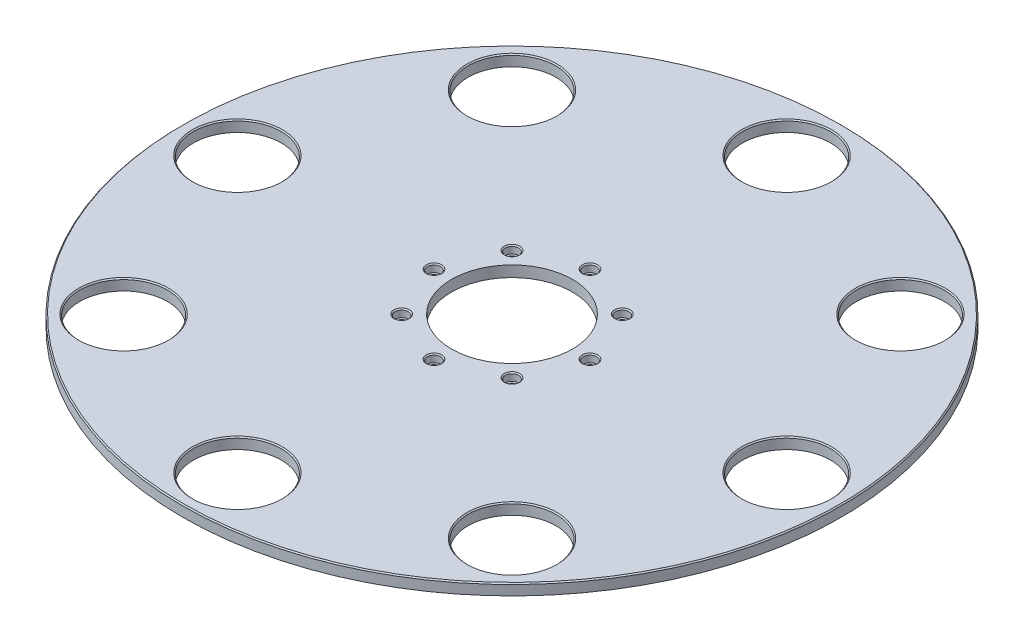
from build123d import *

# Parameters (mm, degrees)
SKETCH2_R            = 300
SKETCH2_R_2          = 55
SKETCH2_R_3          = 40
BOSS_EXTRUDE10_DEPTH = 10
CHAMFER1_SIZE        = 1
SKETCH13_R           = 6
CUT_EXTRUDE1_DEPTH   = 7
SKETCH14_R           = 4
CUT_EXTRUDE2_DEPTH   = 3
CHAMFER2_SIZE        = 1


with BuildPart() as part:
    # Sketch2 → Boss-Extrude10 (new body)
    with BuildSketch(Plane(origin=(0, 0, 0), x_dir=(1, 0, 0), z_dir=(0, 1, 0))):
        with Locations(Location((0, 0, 0), (0, 0, 270))):
            Circle(SKETCH2_R)
        with Locations(Location((0, 0, 0), (0, 0, 270))):
            Circle(SKETCH2_R_2, mode=Mode.SUBTRACT)
        with Locations(Location((0, 250, 0), (0, 0, 270))):
            Circle(SKETCH2_R_3, mode=Mode.SUBTRACT)
        with Locations(Location((176.776695297, 176.776695297, 0), (0, 0, 270))):
            Circle(SKETCH2_R_3, mode=Mode.SUBTRACT)
        with Locations(Location((250, 0, 0), (0, 0, 270))):
            Circle(SKETCH2_R_3, mode=Mode.SUBTRACT)
        with Locations(Location((176.776695297, -176.776695297, 0), (0, 0, 270))):
            Circle(SKETCH2_R_3, mode=Mode.SUBTRACT)
        with Locations(Location((0, -250, 0), (0, 0, 270))):
            Circle(SKETCH2_R_3, mode=Mode.SUBTRACT)
        with Locations(Location((-176.776695297, -176.776695297, 0), (0, 0, 270))):
            Circle(SKETCH2_R_3, mode=Mode.SUBTRACT)
        with Locations(Location((-250, 0, 0), (0, 0, 270))):
            Circle(SKETCH2_R_3, mode=Mode.SUBTRACT)
        with Locations(Location((-176.776695297, 176.776695297, 0), (0, 0, 270))):
            Circle(SKETCH2_R_3, mode=Mode.SUBTRACT)
    extrude(amount=BOSS_EXTRUDE10_DEPTH)

    # Chamfer1
    chamfer1_edges = [part.edges().sort_by_distance(p)[0] for p in [
        (176.776695297, 10, -216.776695297),
        (250, 10, -40),
        (176.776695297, 10, 136.776695297),
        (0, 10, 210),
        (-176.776695297, 10, 136.776695297),
        (-250, 10, -40),
        (-176.776695297, 10, -216.776695297),
        (0, 10, -300),
        (0, 10, -290),
    ]]
    chamfer(chamfer1_edges, length=CHAMFER1_SIZE)

    # Sketch13 → Cut-Extrude1 (cut)
    with BuildSketch(Plane(origin=(0, 10, 0), x_dir=(1, 0, 0), z_dir=(0, 1, 0))):
        with Locations(Location((-71, 0, 0), (0, 0, 270))):
            Circle(SKETCH13_R)
        with Locations(Location((-50.204581464, 50.204581464, 0), (0, 0, 270))):
            Circle(SKETCH13_R)
        with Locations(Location((0, 71, 0), (0, 0, 270))):
            Circle(SKETCH13_R)
        with Locations(Location((50.204581464, 50.204581464, 0), (0, 0, 270))):
            Circle(SKETCH13_R)
        with Locations(Location((71, 0, 0), (0, 0, 270))):
            Circle(SKETCH13_R)
        with Locations(Location((50.204581464, -50.204581464, 0), (0, 0, 270))):
            Circle(SKETCH13_R)
        with Locations(Location((0, -71, 0), (0, 0, 270))):
            Circle(SKETCH13_R)
        with Locations(Location((-50.204581464, -50.204581464, 0), (0, 0, 270))):
            Circle(SKETCH13_R)
    extrude(amount=-CUT_EXTRUDE1_DEPTH, mode=Mode.SUBTRACT)

    # Sketch14 → Cut-Extrude2 (cut)
    with BuildSketch(Plane.XZ):
        with Locations(Location((-71, 0, 0), (0, 0, 270))):
            Circle(SKETCH14_R)
        with Locations(Location((-50.204581464, 50.204581464, 0), (0, 0, 270))):
            Circle(SKETCH14_R)
        with Locations(Location((0, 71, 0), (0, 0, 270))):
            Circle(SKETCH14_R)
        with Locations(Location((50.204581464, 50.204581464, 0), (0, 0, 270))):
            Circle(SKETCH14_R)
        with Locations(Location((71, 0, 0), (0, 0, 270))):
            Circle(SKETCH14_R)
        with Locations(Location((50.204581464, -50.204581464, 0), (0, 0, 270))):
            Circle(SKETCH14_R)
        with Locations(Location((0, -71, 0), (0, 0, 270))):
            Circle(SKETCH14_R)
        with Locations(Location((-50.204581464, -50.204581464, 0), (0, 0, 270))):
            Circle(SKETCH14_R)
    extrude(amount=-CUT_EXTRUDE2_DEPTH, mode=Mode.SUBTRACT)

    # Chamfer2
    chamfer2_edges = [part.edges().sort_by_distance(p)[0] for p in [
        (-71, 10, -6),
        (-50.204581464, 10, -56.204581464),
        (0, 10, -77),
        (50.204581464, 10, -56.204581464),
        (71, 10, -6),
        (50.204581464, 10, 44.204581464),
        (0, 10, 65),
        (-50.204581464, 10, 44.204581464),
    ]]
    chamfer(chamfer2_edges, length=CHAMFER2_SIZE)


solid = part.part
